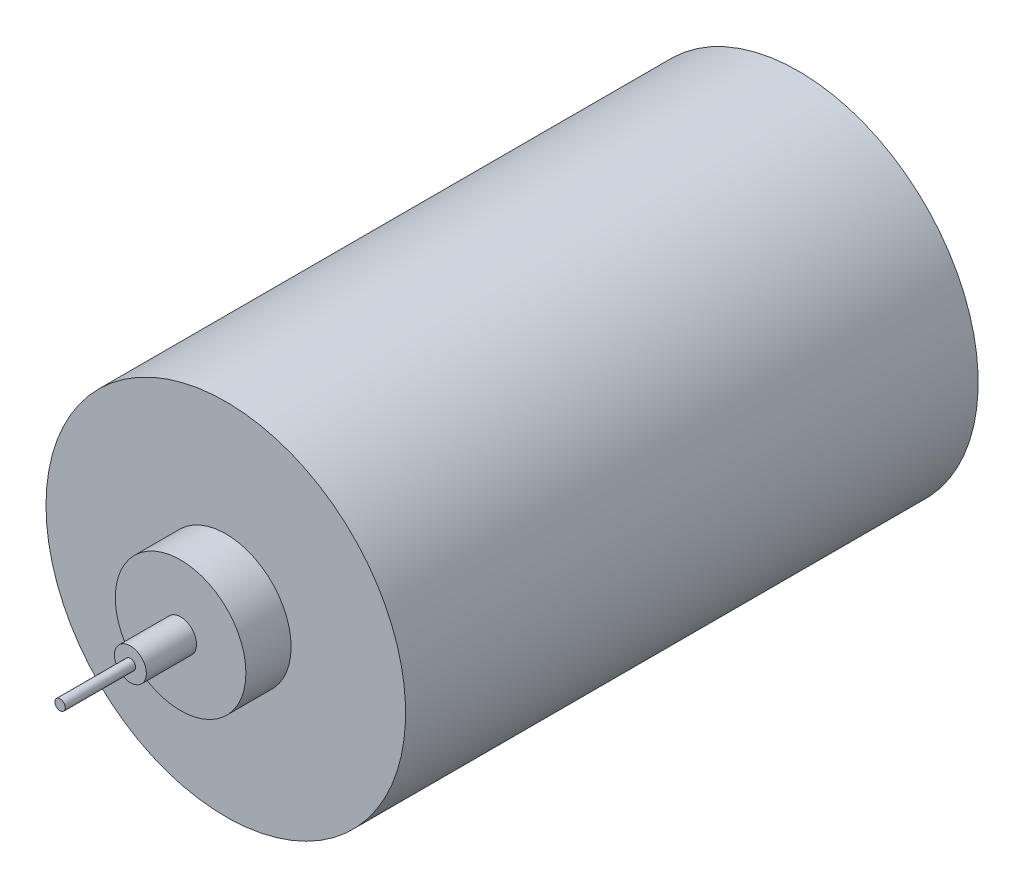
from build123d import *

# Parameters (mm, degrees)
SKETCH1_R           = 17.9
BOSS_EXTRUDE1_DEPTH = 57
SKETCH2_R           = 6.5
BOSS_EXTRUDE2_DEPTH = 4.5
SKETCH3_R           = 1.5875
BOSS_EXTRUDE3_DEPTH = 12
CUT_EXTRUDE1_START  = -7
SKETCH4_R           = 1.5875
SKETCH4_R_2         = 0.518930275
CUT_EXTRUDE1_DEPTH  = 7


with BuildPart() as part:
    # Sketch1 → Boss-Extrude1 (new body)
    with BuildSketch(Plane.XY):
        with Locations(Location((0, 0, 0), (0, 0, 180))):
            Circle(SKETCH1_R)
    extrude(amount=BOSS_EXTRUDE1_DEPTH)

    # Sketch2 → Boss-Extrude2 (add)
    with BuildSketch(Plane.XY.offset(57)):
        Circle(SKETCH2_R)
    extrude(amount=BOSS_EXTRUDE2_DEPTH)

    # Sketch3 → Boss-Extrude3 (add)
    with BuildSketch(Plane.XY.offset(61.5)):
        Circle(SKETCH3_R)
    extrude(amount=BOSS_EXTRUDE3_DEPTH)

    # Sketch4 → Cut-Extrude1 (cut)
    with BuildSketch(Plane.XY.offset(73.5).offset(CUT_EXTRUDE1_START)):
        Circle(SKETCH4_R)
        Circle(SKETCH4_R_2, mode=Mode.SUBTRACT)
    extrude(amount=CUT_EXTRUDE1_DEPTH, mode=Mode.SUBTRACT)


solid = part.part
